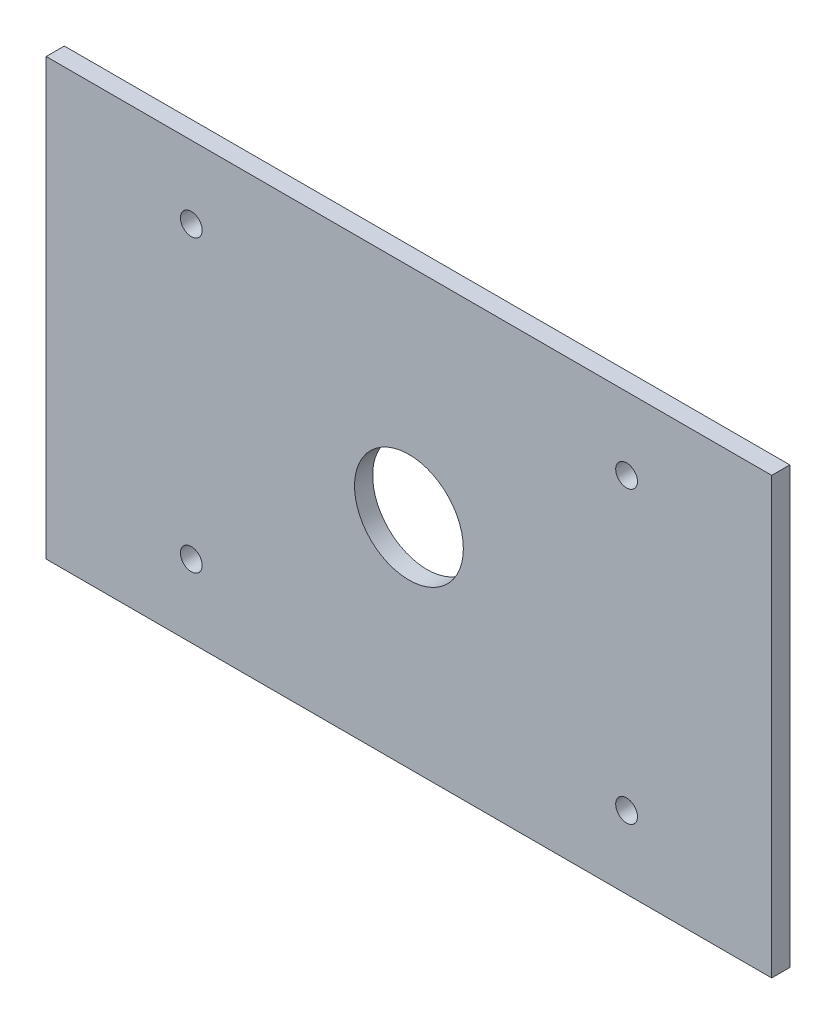
from build123d import *

# Parameters (mm, degrees)
SKETCH1_W                = 127
SKETCH1_H                = 76.2
BOSS_EXTRUDE1_DEPTH      = 3.175
BOSS_EXTRUDE2_DEPTH      = 12.7
BOSS_EXTRUDE2_DEPTH_BACK = 25.4
SKETCH2_R                = 9.525
F_1_2_13_TAPPED_HOLE3_D  = 11.684
THREAD2_PITCH            = 1.953846154
THREAD2_HEIGHT           = 30.32
THREAD2_RADIUS           = 5.842
SKETCH12_R               = 1.905
CUT_EXTRUDE1_DEPTH       = 79.28805787
SKETCH13_R               = 9.525
CUT_EXTRUDE2_DEPTH       = 6.35
SKETCH15_R               = 9.525
CUT_EXTRUDE4_DEPTH       = 81.572467421


with BuildPart() as part:
    # Sketch1 → Boss-Extrude1 (new body)
    with BuildSketch(Plane.XY):
        Rectangle(SKETCH1_W, SKETCH1_H)
    extrude(amount=BOSS_EXTRUDE1_DEPTH)

    # Sketch2 → Boss-Extrude2 (add, two sides: drawn at the far end of the back side and taken through both)
    with BuildSketch(Plane.XY.offset(3.175).offset(-BOSS_EXTRUDE2_DEPTH_BACK)):
        Circle(SKETCH2_R)
    extrude(amount=BOSS_EXTRUDE2_DEPTH + BOSS_EXTRUDE2_DEPTH_BACK)

    # 1/2-13 Tapped Hole3 (through all)
    with Locations(Plane.XY.offset(15.875)):
        with Locations((0, 0)):
            Hole(F_1_2_13_TAPPED_HOLE3_D / 2)

    # Thread2: sweep along a helix
    with BuildLine() as thread2_path:
        Helix(THREAD2_PITCH, THREAD2_HEIGHT, THREAD2_RADIUS, center=(0, 0, 15.875), direction=(0, 0, -1))
    # Thread Profile2 → Thread2 (sweep)
    with BuildSketch(Plane(origin=(-5.842, 0, 15.875), x_dir=(-1, 0, 0), z_dir=(0, -1, 0))):
        Polygon((0, 0), (1.057550248, 0.61057692), (1.057550248, 0.85480769), (0, 1.46538461), align=None)
    sweep(path=thread2_path.line, is_frenet=True)

    # Sketch12 → Cut-Extrude1 (cut, through all)
    with BuildSketch(Plane.XY.offset(3.175)):
        with Locations((-38.1, 25.4)):
            Circle(SKETCH12_R)
        with Locations((-38.1, -25.4)):
            Circle(SKETCH12_R)
        with Locations((38.1, -25.4)):
            Circle(SKETCH12_R)
        with Locations((38.1, 25.4)):
            Circle(SKETCH12_R)
    extrude(amount=-CUT_EXTRUDE1_DEPTH, mode=Mode.SUBTRACT)

    # Sketch13 → Cut-Extrude2 (cut)
    with BuildSketch(Plane.XY.offset(15.875)):
        Circle(SKETCH13_R)
    extrude(amount=-CUT_EXTRUDE2_DEPTH, mode=Mode.SUBTRACT)

    # Sketch15 → Cut-Extrude4 (cut, through all)
    with BuildSketch(Plane.XY.offset(9.525)):
        Circle(SKETCH15_R)
    extrude(amount=-CUT_EXTRUDE4_DEPTH, mode=Mode.SUBTRACT)


solid = part.part
